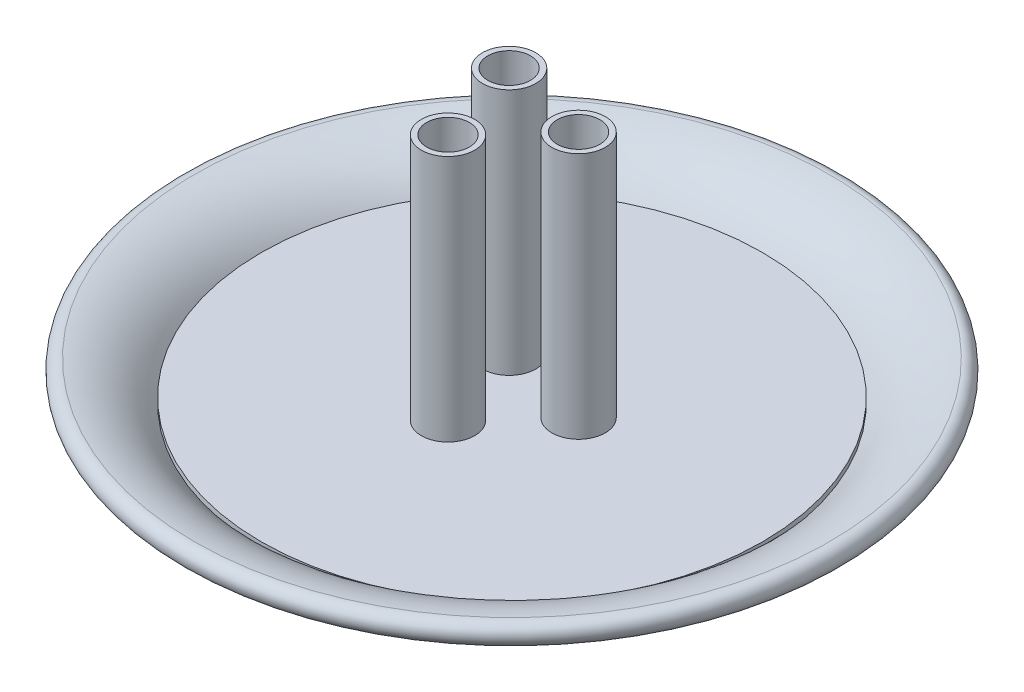
from build123d import *

# Parameters (mm, degrees)
SKETCH2_R           = 2.5
SKETCH2_R_2         = 2
BOSS_EXTRUDE2_DEPTH = 30
SKETCH4_R           = 23.491441723
BOSS_EXTRUDE4_DEPTH = 2


with BuildPart() as part:
    # Sketch1 → Revolve1 (revolve)
    with BuildSketch(Plane.XY, mode=Mode.PRIVATE) as revolve1_sk:
        with BuildLine():
            Line((3.119266055, -4.816513761), (13.119266055, -4.816513761))
            Line((13.119266055, -4.816513761), (13.119266055, -2.816513761))
            Line((13.119266055, -2.816513761), (3.257916771, -2.816513761))
            ThreePointArc((3.257916771, -2.816513761), (-4.025816821, -0.658797724), (-10.372175668, 3.516396035))
            ThreePointArc((-10.372175668, 3.516396035), (-13.131249362, 6.018603225), (-16.672681055, 7.172635302))
            ThreePointArc((-16.672681055, 7.172635302), (-17.771282031, 6.282087215), (-16.880733945, 5.183486239))
            ThreePointArc((-16.880733945, 5.183486239), (-14.048292509, 4.237555299), (-11.880733945, 2.183486239))
            ThreePointArc((-11.880733945, 2.183486239), (-4.911005239, -2.452809391), (3.119266055, -4.816513761))
        make_face()
    revolve(revolve1_sk.sketch.rotate(Axis((13.119266055, -2.816513761, 0), (0, -1, 0)), 270), axis=Axis((13.119266055, -2.816513761, 0), (0, -1, 0)))

    # Sketch2 → Boss-Extrude2 (add)
    # profile 1 of 3: a face of its own
    with BuildSketch(Plane(origin=(0, -2.816513761, 0), x_dir=(1, 0, 0), z_dir=(0, 1, 0))):
        with Locations(Location((9.455762685, 3.402755216, 0), (0, 0, 270))):
            Circle(SKETCH2_R)
        with Locations(Location((9.455762685, 3.402755216, 0), (0, 0, 270))):
            Circle(SKETCH2_R_2, mode=Mode.SUBTRACT)
    # profile 2 of 3: a face of its own
    with BuildSketch(Plane(origin=(0, -2.816513761, 0), x_dir=(1, 0, 0), z_dir=(0, 1, 0))):
        with Locations(Location((17.8978902, 1.471309377, 0), (0, 0, 270))):
            Circle(SKETCH2_R)
        with Locations(Location((17.8978902, 1.471309377, 0), (0, 0, 270))):
            Circle(SKETCH2_R_2, mode=Mode.SUBTRACT)
    # profile 3 of 3: a face of its own
    with BuildSketch(Plane(origin=(0, -2.816513761, 0), x_dir=(1, 0, 0), z_dir=(0, 1, 0))):
        with Locations(Location((12.00414528, -4.874064593, 0), (0, 0, 270))):
            Circle(SKETCH2_R)
        with Locations(Location((12.00414528, -4.874064593, 0), (0, 0, 270))):
            Circle(SKETCH2_R_2, mode=Mode.SUBTRACT)
    extrude(amount=BOSS_EXTRUDE2_DEPTH)

    # Sketch4 → Boss-Extrude4 (add)
    with BuildSketch(Plane(origin=(0, 2, 0), x_dir=(1, 0, 0), z_dir=(0, 1, 0))):
        with Locations(Location((13.119266055, 0, 0), (0, 0, 270))):
            Circle(SKETCH4_R)
    extrude(amount=BOSS_EXTRUDE4_DEPTH)


solid = part.part
